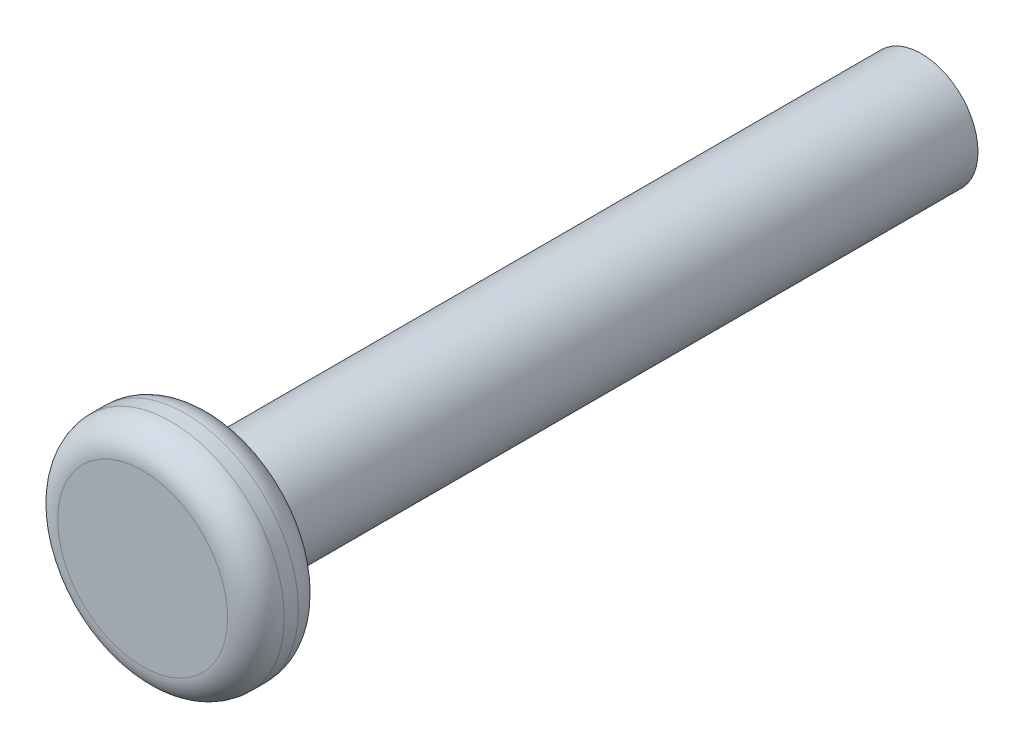
from build123d import *

# Parameters (mm, degrees)
SKETCH1_R           = 4
BOSS_EXTRUDE1_DEPTH = 50
SKETCH2_R           = 8
BOSS_EXTRUDE2_DEPTH = 5
FILLET2_R           = 2


with BuildPart() as part:
    # Sketch1 → Boss-Extrude1 (new body)
    with BuildSketch(Plane.XY):
        Circle(SKETCH1_R)
    extrude(amount=BOSS_EXTRUDE1_DEPTH)

    # Sketch2 → Boss-Extrude2 (add)
    with BuildSketch(Plane.XY.offset(50)):
        Circle(SKETCH2_R)
    extrude(amount=BOSS_EXTRUDE2_DEPTH)

    # Fillet2
    fillet2_edges = [part.edges().sort_by_distance(p)[0] for p in [
        (-8, 0, 50),
        (-8, 0, 55),
    ]]
    fillet(fillet2_edges, radius=FILLET2_R)


solid = part.part
